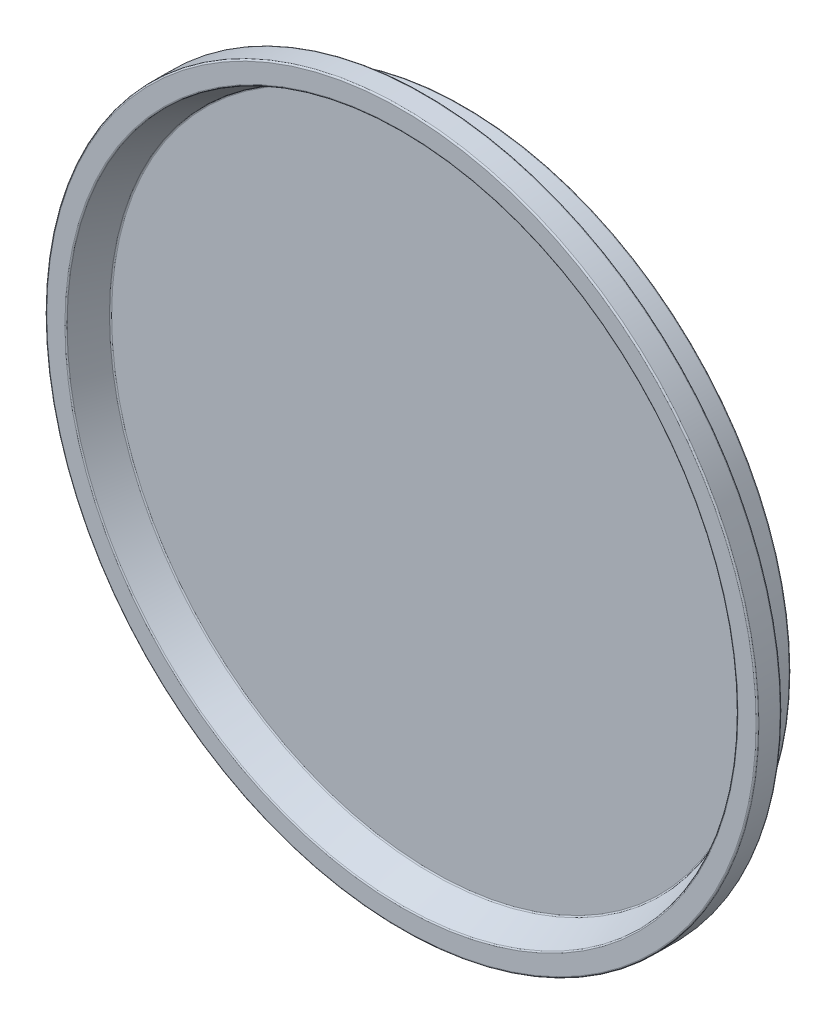
from build123d import *

# Parameters (mm, degrees)
FILLET1_R = 0.762


with BuildPart() as part:
    # Sketch1 → Revolve1 (revolve)
    with BuildSketch(Plane(origin=(0, 0, 0), x_dir=(-1, 0, 0), z_dir=(0, 1, 0))):
        Polygon((0, 2.2), (169.545, 2.2), (176.53, 18.796), (187.325, 18.796), (187.325, 6.096), (185.125, 6.096), (185.125, 16.596), (177.99097167, 16.596), (171.745, 1.755893224), (171.745, -14.224), (169.545, -14.224), (169.545, 0), (0, 0), align=None)
    revolve(axis=Axis((0, 0, 0), (0, 0, 1)))

    # Fillet1
    fillet1_edges = [part.edges().sort_by_distance(p)[0] for p in [
        (169.545, 0, 0),
        (169.545, 0, -14.224),
        (171.745, 0, -14.224),
        (171.745, 0, 1.755893224),
        (177.99097167, 0, 16.596),
        (185.125, 0, 16.596),
        (185.125, 0, 6.096),
        (187.325, 0, 6.096),
        (187.325, 0, 18.796),
        (176.53, 0, 18.796),
        (169.545, 0, 2.2),
    ]]
    fillet(fillet1_edges, radius=FILLET1_R)


solid = part.part
